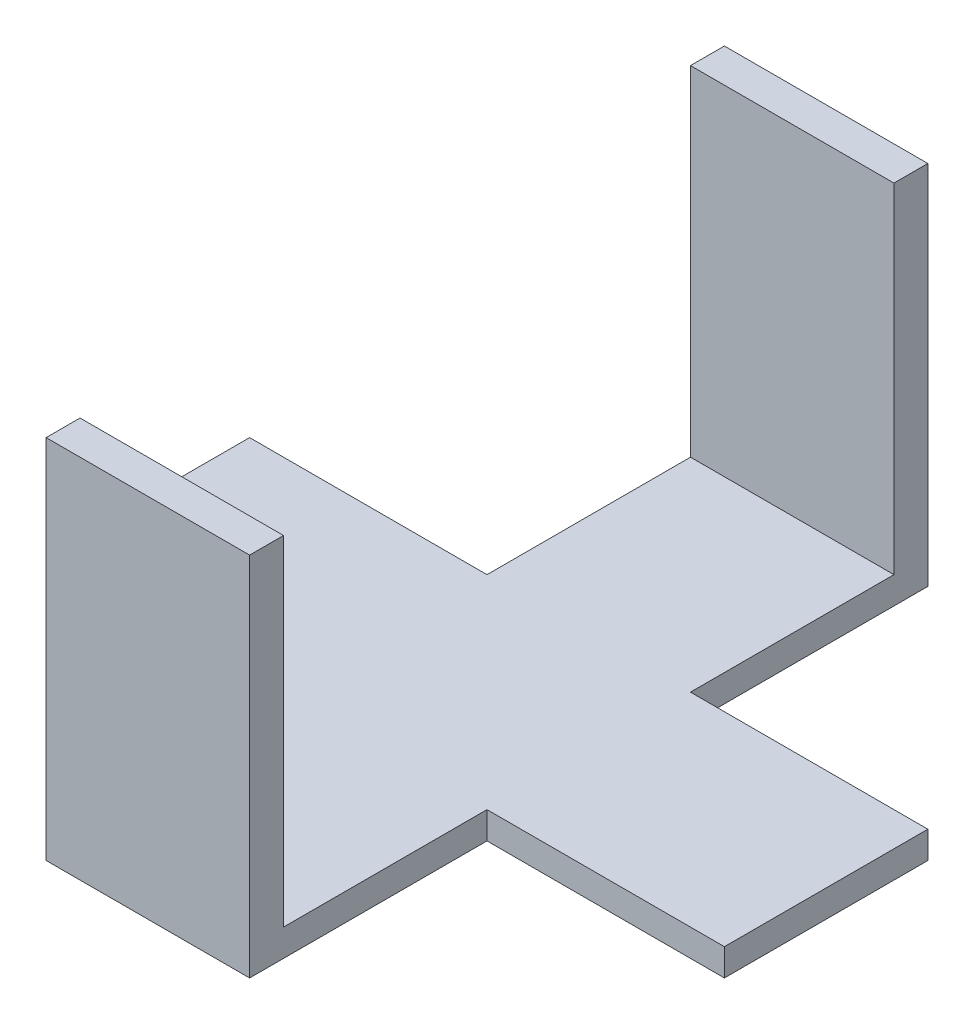
from build123d import *

# Parameters (mm, degrees)
BOSS_EXTRUDE3_DEPTH = 4
SKETCH4_W           = 30
SKETCH4_H           = 5
BOSS_EXTRUDE4_DEPTH = 50


with BuildPart() as part:
    # Sketch3 → Boss-Extrude3 (new body)
    with BuildSketch(Plane(origin=(0, 0, 0), x_dir=(1, 0, 0), z_dir=(0, 1, 0))):
        Polygon((-15, -15), (-15, -50), (15, -50), (15, -15), (50, -15), (50, 15), (15, 15), (15, 50), (-15, 50), (-15, 15), (-50, 15), (-50, -15), align=None)
    extrude(amount=BOSS_EXTRUDE3_DEPTH)

    # Sketch4 → Boss-Extrude4 (add)
    with BuildSketch(Plane(origin=(0, 4, 0), x_dir=(1, 0, 0), z_dir=(0, 1, 0))):
        with Locations((0, -47.5)):
            Rectangle(SKETCH4_W, SKETCH4_H)
        with Locations((0, 47.5)):
            Rectangle(SKETCH4_W, SKETCH4_H)
    extrude(amount=BOSS_EXTRUDE4_DEPTH)


solid = part.part
